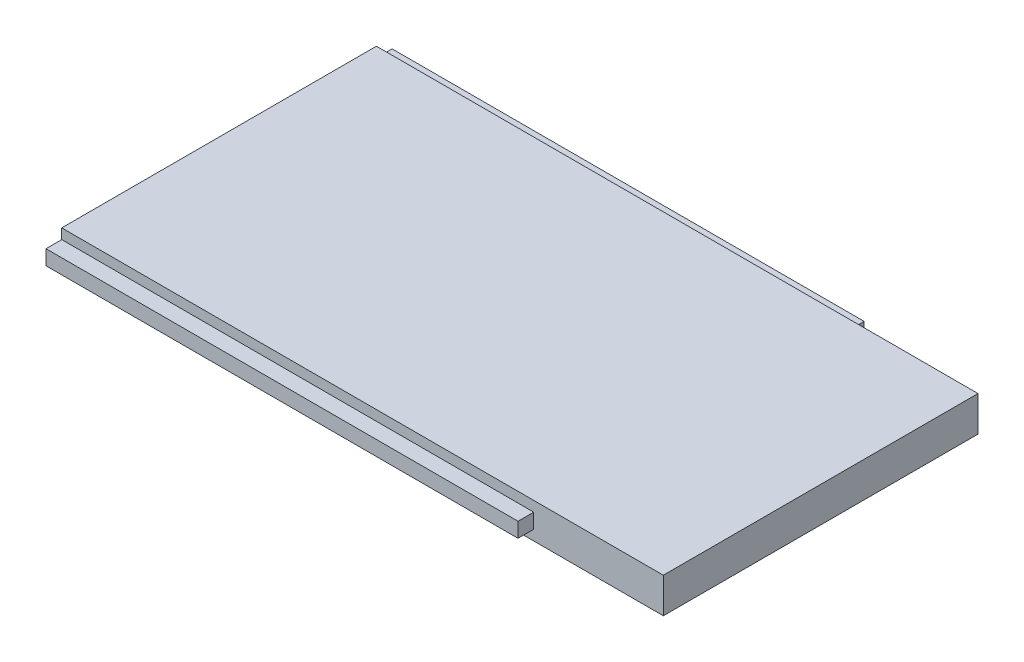
from build123d import *

# Parameters (mm, degrees)
SKETCH_1_W      = 65
SKETCH_1_H      = 34
EXTRUDE_1_DEPTH = 3.8
SKETCH_2_W      = 51
SKETCH_2_H      = 1.6
EXTRUDE_2_DEPTH = 1.7


with BuildPart() as part:
    # 草图1 → 凸台-拉伸1 (new body)
    with BuildSketch(Plane(origin=(0, 0, 0), x_dir=(1, 0, 0), z_dir=(0, 1, 0))):
        with Locations((32.5, 17)):
            Rectangle(SKETCH_1_W, SKETCH_1_H)
    extrude(amount=EXTRUDE_1_DEPTH)

    # 草图2 → 凸台-拉伸2 (add)
    with BuildSketch(Plane(origin=(0, 0, -34), x_dir=(-1, 0, 0), z_dir=(0, 0, -1))):
        with Locations((-25.5, 1.9)):
            Rectangle(SKETCH_2_W, SKETCH_2_H)
    extrude_2 = extrude(amount=EXTRUDE_2_DEPTH)

    # 镜向1: 凸台-拉伸2 across plane
    add(extrude_2.mirror(Plane.XY.offset(-17)))


solid = part.part
